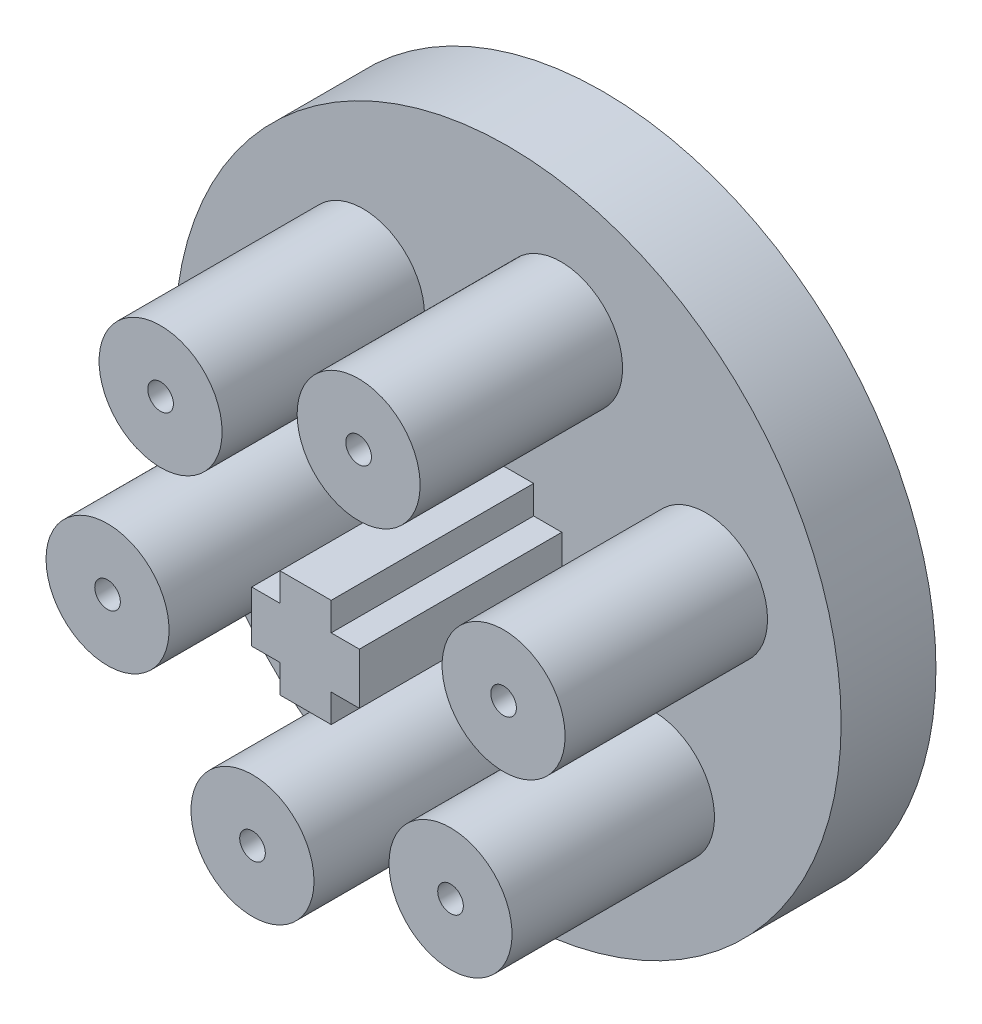
from build123d import *

# Parameters (mm, degrees)
SKETCH_1_R               = 13
EXTRUDE_1_DEPTH          = 3.7
SKETCH_2_W               = 2
SKETCH_2_H               = 4.2
SKETCH_2_W_2             = 4.2
SKETCH_2_H_2             = 2
EXTRUDE_2_DEPTH          = 7.9
SKETCH_3_R               = 2.4
SKETCH_3_R_2             = 0.5
EXTRUDE_3_DEPTH          = 7.9
PATTERN_CIRCULAR_1_COUNT = 6


with BuildPart() as part:
    # 草图1 → 凸台-拉伸1 (new body)
    with BuildSketch(Plane.XY):
        Circle(SKETCH_1_R)
    extrude(amount=EXTRUDE_1_DEPTH)

    # 草图2 → 凸台-拉伸2 (add)
    with BuildSketch(Plane.XY.offset(3.7)):
        Rectangle(SKETCH_2_W, SKETCH_2_H)
        Rectangle(SKETCH_2_W_2, SKETCH_2_H_2)
    extrude(amount=EXTRUDE_2_DEPTH)

    # 草图3 → 凸台-拉伸3 (add)
    with BuildSketch(Plane.XY.offset(3.7)):
        with Locations((-5.656854249, 5.656854249)):
            Circle(SKETCH_3_R)
        with Locations((-5.656854249, 5.656854249)):
            Circle(SKETCH_3_R_2, mode=Mode.SUBTRACT)
    extrude_3 = extrude(amount=EXTRUDE_3_DEPTH)

    # 阵列(圆周)1: 凸台-拉伸3 ×6 about axis
    pattern_circular_1_axis = Axis((0, 0, 0), (0, 0, 1))
    for i in range(1, PATTERN_CIRCULAR_1_COUNT):
        add(extrude_3.rotate(pattern_circular_1_axis, i * 360 / PATTERN_CIRCULAR_1_COUNT))


solid = part.part
